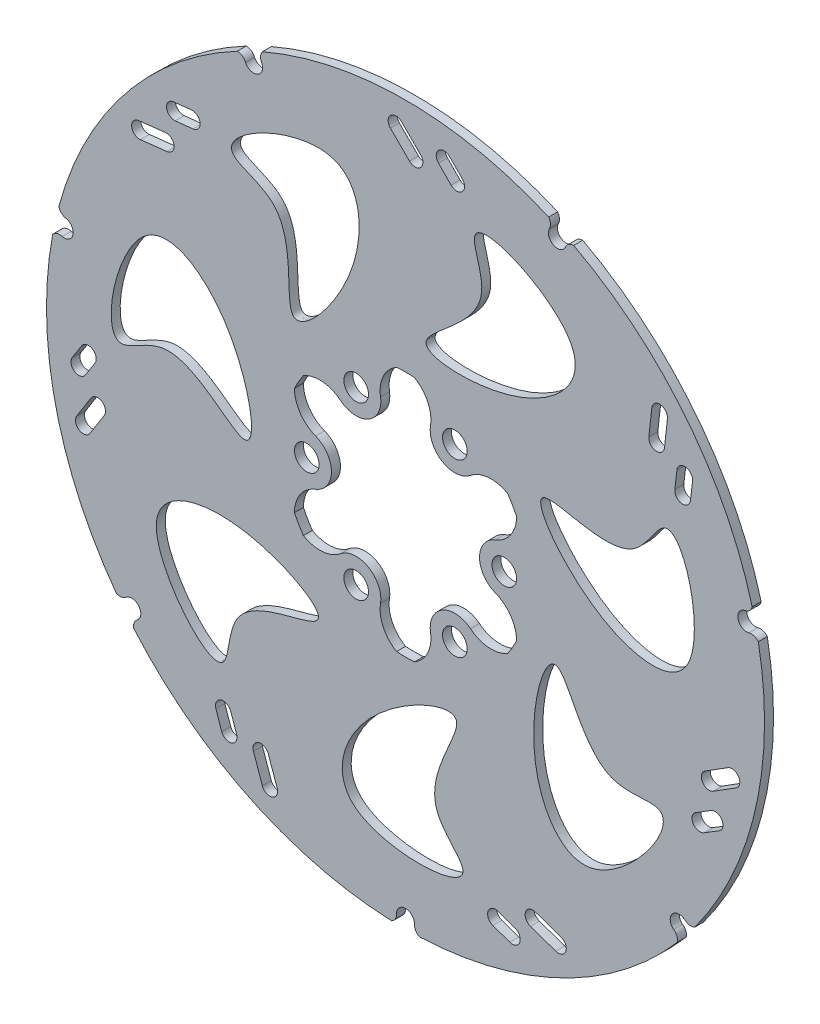
from build123d import *

# Parameters (mm, degrees)
SZKIC1_R                    = 2.75
DODANIE_WYCI_GNI_CIE1_DEPTH = 2


with BuildPart() as part:
    # Szkic1 → Dodanie-wyciągnięcie1 (new body)
    with BuildSketch(Plane.XY):
        with BuildLine():
            ThreePointArc((64.431324033, -47.419452584), (77.994232975, -17.801674717), (78.625146465, 14.767746723))
            ThreePointArc((78.625146465, 14.767746723), (77.654574139, 15.41242315), (76.489419018, 15.406777024))
            ThreePointArc((76.489419018, 15.406777024), (74.094521326, 16.911590981), (75.599335282, 19.306488673))
            ThreePointArc((75.599335282, 19.306488673), (76.651553535, 19.80694355), (77.246294366, 20.80889249))
            ThreePointArc((77.246294366, 20.80889249), (62.546518597, 49.879184149), (37.476087678, 70.679154299))
            ThreePointArc((37.476087678, 70.679154299), (36.366917404, 70.322279476), (35.644869387, 69.407804218))
            ThreePointArc((35.644869387, 69.407804218), (32.975164173, 68.473633961), (32.040993915, 71.143339175))
            ThreePointArc((32.040993915, 71.143339175), (32.305769887, 72.278025043), (31.893229504, 73.367717095))
            ThreePointArc((31.893229504, 73.367717095), (0, 80), (-31.893229504, 73.367717095))
            ThreePointArc((-31.893229504, 73.367717095), (-32.305769887, 72.278025043), (-32.040993915, 71.143339175))
            ThreePointArc((-32.040993915, 71.143339175), (-32.975164173, 68.473633961), (-35.644869387, 69.407804218))
            ThreePointArc((-35.644869387, 69.407804218), (-36.366917404, 70.322279476), (-37.476087678, 70.679154299))
            ThreePointArc((-37.476087678, 70.679154299), (-62.546518597, 49.879184149), (-77.246294366, 20.80889249))
            ThreePointArc((-77.246294366, 20.80889249), (-76.651553535, 19.80694355), (-75.599335282, 19.306488673))
            ThreePointArc((-75.599335282, 19.306488673), (-74.094521326, 16.911590981), (-76.489419018, 15.406777024))
            ThreePointArc((-76.489419018, 15.406777024), (-77.654574139, 15.41242315), (-78.625146465, 14.767746723))
            ThreePointArc((-78.625146465, 14.767746723), (-77.994232975, -17.801674717), (-64.431324033, -47.419452584))
            ThreePointArc((-64.431324033, -47.419452584), (-63.277153965, -47.579170424), (-62.229835236, -47.06854158))
            ThreePointArc((-62.229835236, -47.06854158), (-59.419192668, -47.385224941), (-59.735876029, -50.19586751))
            ThreePointArc((-59.735876029, -50.19586751), (-60.466752683, -51.103302164), (-60.567866304, -52.264075342))
            ThreePointArc((-60.567866304, -52.264075342), (-34.710699129, -72.077509432), (-3.098252543, -79.939982682))
            ThreePointArc((-3.098252543, -79.939982682), (-2.25376684, -79.137198631), (-2, -78))
            ThreePointArc((-2, -78), (0, -76), (2, -78))
            ThreePointArc((2, -78), (2.25376684, -79.137198631), (3.098252543, -79.939982682))
            ThreePointArc((3.098252543, -79.939982682), (34.710699129, -72.077509432), (60.567866304, -52.264075342))
            ThreePointArc((60.567866304, -52.264075342), (60.466752683, -51.103302164), (59.735876029, -50.19586751))
            ThreePointArc((59.735876029, -50.19586751), (59.419192668, -47.385224941), (62.229835236, -47.06854158))
            ThreePointArc((62.229835236, -47.06854158), (63.277153965, -47.579170424), (64.431324033, -47.419452584))
        make_face()
        with BuildLine():
            Line((-30.578670574, -61.46012014), (-28.596996203, -67.123420121))
            ThreePointArc((-28.596996203, -67.123420121), (-29.670803672, -69.353204308), (-31.900587859, -68.279396838))
            Line((-31.900587859, -68.279396838), (-33.88226223, -62.616096856))
            ThreePointArc((-33.88226223, -62.616096856), (-32.808454761, -60.38631267), (-30.578670574, -61.46012014))
        make_face(mode=Mode.SUBTRACT)
        with BuildLine():
            Line((-38.939091508, -57.443026318), (-37.642862362, -61.227176156))
            ThreePointArc((-37.642862362, -61.227176156), (-38.731327664, -63.449841962), (-40.95399347, -62.361376659))
            Line((-40.95399347, -62.361376659), (-42.250222617, -58.577226821))
            ThreePointArc((-42.250222617, -58.577226821), (-41.161757314, -56.354561015), (-38.939091508, -57.443026318))
        make_face(mode=Mode.SUBTRACT)
        with BuildLine():
            Line((-67.116946099, -14.412390781), (-70.309138558, -19.492735976))
            ThreePointArc((-70.309138558, -19.492735976), (-72.721962041, -20.043447191), (-73.272673255, -17.630623709))
            Line((-73.272673255, -17.630623709), (-70.080480796, -12.550278513))
            ThreePointArc((-70.080480796, -12.550278513), (-67.667657314, -11.999567299), (-67.116946099, -14.412390781))
        make_face(mode=Mode.SUBTRACT)
        with BuildLine():
            Line((-69.188892872, -5.371333457), (-71.339274697, -8.744145045))
            ThreePointArc((-71.339274697, -8.744145045), (-73.755671814, -9.278958067), (-74.290484836, -6.862560949))
            Line((-74.290484836, -6.862560949), (-72.140103012, -3.489749361))
            ThreePointArc((-72.140103012, -3.489749361), (-69.723705894, -2.954936339), (-69.188892872, -5.371333457))
        make_face(mode=Mode.SUBTRACT)
        with BuildLine():
            add(Edge.make_bspline(
                [(-40.524056939, -48.624719117), (-39.225938766, -46.991885737), (-40.113964183, -32.51232106), (-8.131634609, -32.692607337), (-38.189540499, -16.767804192), (-65.726373197, -26.38628151), (-43.600964975, -52.494997069), (-40.524056939, -48.624719117)],
                knots=[0, 0, 0, 0, 0.107237033, 0.3200973, 0.532957568, 0.745817835, 1, 1, 1, 1], degree=3))
        make_face(mode=Mode.SUBTRACT)
        with BuildLine():
            ThreePointArc((24.75, 11.986972095), (23.457532788, 7.829362892), (20.035714286, 5.137273755))
            ThreePointArc((20.035714286, 5.137273755), (16.5, 0), (20.035714286, -5.137273755))
            ThreePointArc((20.035714286, -5.137273755), (23.457532788, -7.829362892), (24.75, -11.986972095))
            ThreePointArc((24.75, -11.986972095), (23.815698604, -13.75), (22.756022348, -15.440642696))
            ThreePointArc((22.756022348, -15.440642696), (18.509193553, -16.400137858), (14.466866721, -14.782800677))
            ThreePointArc((14.466866721, -14.782800677), (8.25, -14.289419162), (5.568847565, -19.920074432))
            ThreePointArc((5.568847565, -19.920074432), (4.948339234, -24.22950075), (1.993977652, -27.427614791))
            ThreePointArc((1.993977652, -27.427614791), (0, -27.5), (-1.993977652, -27.427614791))
            ThreePointArc((-1.993977652, -27.427614791), (-4.948339234, -24.22950075), (-5.568847565, -19.920074432))
            ThreePointArc((-5.568847565, -19.920074432), (-8.25, -14.289419162), (-14.466866721, -14.782800677))
            ThreePointArc((-14.466866721, -14.782800677), (-18.509193553, -16.400137858), (-22.756022348, -15.440642696))
            ThreePointArc((-22.756022348, -15.440642696), (-23.815698604, -13.75), (-24.75, -11.986972095))
            ThreePointArc((-24.75, -11.986972095), (-23.457532788, -7.829362892), (-20.035714286, -5.137273755))
            ThreePointArc((-20.035714286, -5.137273755), (-16.5, 0), (-20.035714286, 5.137273755))
            ThreePointArc((-20.035714286, 5.137273755), (-23.457532788, 7.829362892), (-24.75, 11.986972095))
            ThreePointArc((-24.75, 11.986972095), (-23.815698604, 13.75), (-22.756022348, 15.440642696))
            ThreePointArc((-22.756022348, 15.440642696), (-18.509193553, 16.400137858), (-14.466866721, 14.782800677))
            ThreePointArc((-14.466866721, 14.782800677), (-8.25, 14.289419162), (-5.568847565, 19.920074432))
            ThreePointArc((-5.568847565, 19.920074432), (-4.948339234, 24.22950075), (-1.993977652, 27.427614791))
            ThreePointArc((-1.993977652, 27.427614791), (0, 27.5), (1.993977652, 27.427614791))
            ThreePointArc((1.993977652, 27.427614791), (4.948339234, 24.22950075), (5.568847565, 19.920074432))
            ThreePointArc((5.568847565, 19.920074432), (8.25, 14.289419162), (14.466866721, 14.782800677))
            ThreePointArc((14.466866721, 14.782800677), (18.509193553, 16.400137858), (22.756022348, 15.440642696))
            ThreePointArc((22.756022348, 15.440642696), (23.815698604, 13.75), (24.75, 11.986972095))
        make_face(mode=Mode.SUBTRACT)
        with BuildLine():
            Line((20.632639974, -66.258948737), (24.399393106, -67.604894814))
            ThreePointArc((24.399393106, -67.604894814), (25.458496192, -69.841700718), (23.221690288, -70.900803805))
            Line((23.221690288, -70.900803805), (19.454937156, -69.554857727))
            ThreePointArc((19.454937156, -69.554857727), (18.39583407, -67.318051823), (20.632639974, -66.258948737))
        make_face(mode=Mode.SUBTRACT)
        with BuildLine():
            Line((28.985967584, -62.227125475), (34.649267566, -64.208799847))
            ThreePointArc((34.649267566, -64.208799847), (35.723075035, -66.438584033), (33.493290849, -67.512391503))
            Line((33.493290849, -67.512391503), (27.829990867, -65.530717131))
            ThreePointArc((27.829990867, -65.530717131), (26.756183397, -63.300932945), (28.985967584, -62.227125475))
        make_face(mode=Mode.SUBTRACT)
        with BuildLine():
            add(Edge.make_bspline(
                [(12.75, -62), (12.282762901, -59.967035383), (0.408508593, -51.6334607), (20.490118409, -26.741075212), (-10.70119183, -40.312339976), (-20.350097812, -67.838525224), (13.857484368, -66.818702405), (12.75, -62)],
                knots=[0, 0, 0, 0, 0.107237033, 0.3200973, 0.532957568, 0.745817835, 1, 1, 1, 1], degree=3))
        make_face(mode=Mode.SUBTRACT)
        with BuildLine():
            add(Edge.make_bspline(
                [(56.423046887, -28.688016314), (54.54229358, -27.785784282), (40.623366066, -31.873551303), (33.682394342, -0.652968034), (24.845372552, -33.500861536), (40.350216292, -58.206975791), (60.88096534, -30.826561976), (56.423046887, -28.688016314)],
                knots=[0, 0, 0, 0, 0.107237033, 0.3200973, 0.532957568, 0.745817835, 1, 1, 1, 1], degree=3))
        make_face(mode=Mode.SUBTRACT)
        with BuildLine():
            Line((64.667572727, -25.180531321), (68.068407908, -23.074748789))
            ThreePointArc((68.068407908, -23.074748789), (70.477553157, -23.641334323), (69.910967623, -26.050479572))
            Line((69.910967623, -26.050479572), (66.510132442, -28.156262104))
            ThreePointArc((66.510132442, -28.156262104), (64.100987193, -27.58967657), (64.667572727, -25.180531321))
        make_face(mode=Mode.SUBTRACT)
        with BuildLine():
            Line((66.723580946, -16.135836126), (71.803926141, -12.943643667))
            ThreePointArc((71.803926141, -12.943643667), (74.216749623, -13.494354881), (73.666038409, -15.907178364))
            Line((73.666038409, -15.907178364), (68.585693213, -19.099370823))
            ThreePointArc((68.585693213, -19.099370823), (66.172869731, -18.548659608), (66.723580946, -16.135836126))
        make_face(mode=Mode.SUBTRACT)
        with BuildLine():
            add(Edge.make_bspline(
                [(-63.282672463, 1.365967025), (-61.196708478, 1.369112329), (-50.429803753, 11.091259469), (-30.630100911, -14.02593933), (-36.920386248, 19.40323015), (-61.609348991, 34.935370364), (-68.226998394, 1.358511762), (-63.282672463, 1.365967025)],
                knots=[0, 0, 0, 0, 0.107237033, 0.3200973, 0.532957568, 0.745817835, 1, 1, 1, 1], degree=3))
        make_face(mode=Mode.SUBTRACT)
        with BuildLine():
            Line((-53.114792275, 43.488162795), (-59.077065534, 42.816375938))
            ThreePointArc((-59.077065534, 42.816375938), (-61.011999735, 44.359434472), (-59.468941201, 46.294368673))
            Line((-59.468941201, 46.294368673), (-53.506667941, 46.966155529))
            ThreePointArc((-53.506667941, 46.966155529), (-51.571733741, 45.423096995), (-53.114792275, 43.488162795))
        make_face(mode=Mode.SUBTRACT)
        with BuildLine():
            Line((-47.338046707, 50.745083052), (-51.315758129, 50.323405632))
            ThreePointArc((-51.315758129, 50.323405632), (-53.240490747, 51.879170508), (-51.684725871, 53.803903126))
            Line((-51.684725871, 53.803903126), (-47.707014449, 54.225580546))
            ThreePointArc((-47.707014449, 54.225580546), (-45.782281831, 52.66981567), (-47.338046707, 50.745083052))
        make_face(mode=Mode.SUBTRACT)
        with BuildLine():
            add(Edge.make_bspline(
                [(-38.388144891, 50.328052136), (-37.085108522, 48.699140887), (-22.770972517, 46.342895397), (-30.063476487, 15.20254707), (-7.849428114, 40.963236435), (-11.099228393, 69.949975802), (-41.476710445, 54.189033528), (-38.388144891, 50.328052136)],
                knots=[0, 0, 0, 0, 0.107237033, 0.3200973, 0.532957568, 0.745817835, 1, 1, 1, 1], degree=3))
        make_face(mode=Mode.SUBTRACT)
        with BuildLine():
            add(Edge.make_bspline(
                [(57.608388647, 26.226628786), (55.730364734, 25.318729111), (50.248000326, 11.887792328), (21.51114034, 25.926837392), (41.682864648, -1.462551067), (70.665994534, -4.744386381), (62.059837666, 28.378608367), (57.608388647, 26.226628786)],
                knots=[0, 0, 0, 0, 0.107237033, 0.3200973, 0.532957568, 0.745817835, 1, 1, 1, 1], degree=3))
        make_face(mode=Mode.SUBTRACT)
        with BuildLine():
            Line((60.006504238, 34.859339769), (60.480523213, 38.831153713))
            ThreePointArc((60.480523213, 38.831153713), (62.425575115, 40.361439013), (63.955860414, 38.416387111))
            Line((63.955860414, 38.416387111), (63.48184144, 34.444573166))
            ThreePointArc((63.48184144, 34.444573166), (61.536789538, 32.914287867), (60.006504238, 34.859339769))
        make_face(mode=Mode.SUBTRACT)
        with BuildLine():
            add(Edge.make_bspline(
                [(15.41343876, 61.392087484), (14.95233455, 59.357723075), (22.034865468, 46.697385869), (-6.858441085, 32.98320545), (27.132309489, 31.677090187), (47.768837568, 52.290822741), (16.50638644, 66.214107792), (15.41343876, 61.392087484)],
                knots=[0, 0, 0, 0, 0.107237033, 0.3200973, 0.532957568, 0.745817835, 1, 1, 1, 1], degree=3))
        make_face(mode=Mode.SUBTRACT)
        with BuildLine():
            ThreePointArc((-3.358757211, 72.883883476), (-3.358757211, 75.358757211), (-0.883883476, 75.358757211))
            Line((-0.883883476, 75.358757211), (3.358757211, 71.116116524))
            ThreePointArc((3.358757211, 71.116116524), (3.358757211, 68.641242789), (0.883883476, 68.641242789))
            Line((0.883883476, 68.641242789), (-3.358757211, 72.883883476))
        make_face(mode=Mode.SUBTRACT)
        with BuildLine():
            ThreePointArc((7.34957096, 71.496405459), (7.365865761, 73.971225549), (9.840685851, 73.954930748))
            Line((9.840685851, 73.954930748), (12.65042904, 71.107942301))
            ThreePointArc((12.65042904, 71.107942301), (12.634134239, 68.633122211), (10.159314149, 68.649417012))
            Line((10.159314149, 68.649417012), (7.34957096, 71.496405459))
        make_face(mode=Mode.SUBTRACT)
        with BuildLine():
            Line((54.216976942, 42.106066937), (54.888763799, 48.068340197))
            ThreePointArc((54.888763799, 48.068340197), (56.823697999, 49.611398731), (58.366756533, 47.67646453))
            Line((58.366756533, 47.67646453), (57.694969677, 41.714191271))
            ThreePointArc((57.694969677, 41.714191271), (55.760035476, 40.171132737), (54.216976942, 42.106066937))
        make_face(mode=Mode.SUBTRACT)
        with Locations((22, 0)):
            Circle(SZKIC1_R, mode=Mode.SUBTRACT)
        with Locations((11, 19.052558883)):
            Circle(SZKIC1_R, mode=Mode.SUBTRACT)
        with Locations((11, -19.052558883)):
            Circle(SZKIC1_R, mode=Mode.SUBTRACT)
        with Locations((-11, 19.052558883)):
            Circle(SZKIC1_R, mode=Mode.SUBTRACT)
        with Locations((-11, -19.052558883)):
            Circle(SZKIC1_R, mode=Mode.SUBTRACT)
        with Locations((-22, 0)):
            Circle(SZKIC1_R, mode=Mode.SUBTRACT)
    extrude(amount=DODANIE_WYCI_GNI_CIE1_DEPTH)


solid = part.part
